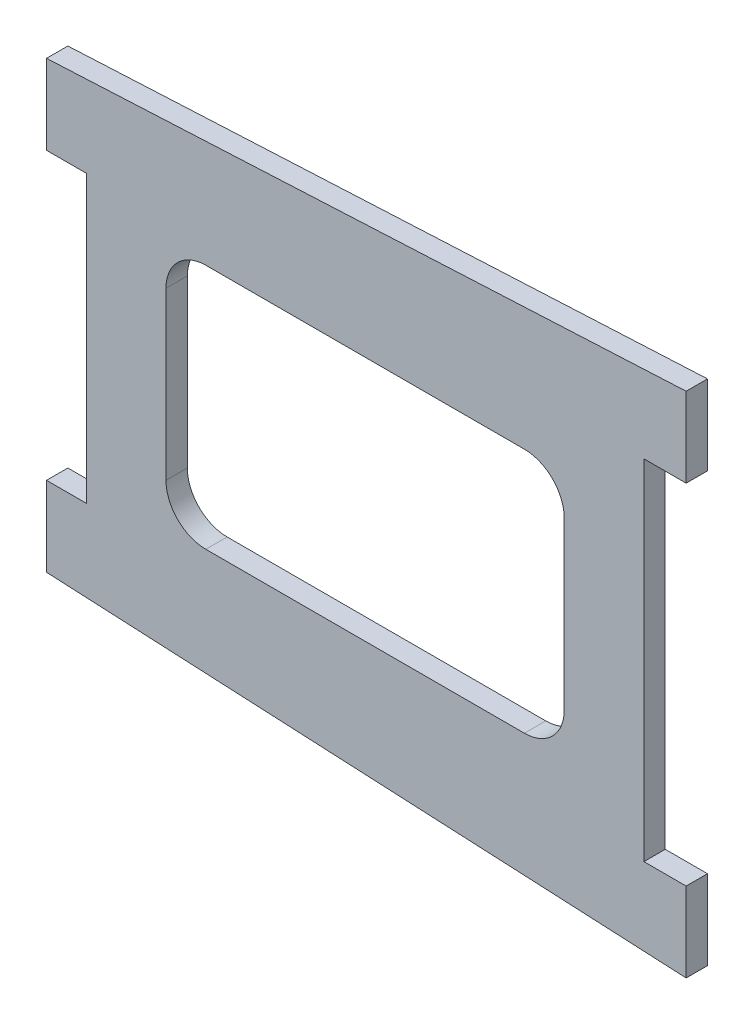
from build123d import *

# Parameters (mm, degrees)
BOSS_EXTRUDE1_DEPTH = 3.4036


with BuildPart() as part:
    # Sketch1 → Boss-Extrude1 (new body)
    with BuildSketch(Plane.XY):
        Polygon((8689.636759917, 2979.750055989), (8587.64819291, 2974.720855989), (8587.64819291, 2962.020855989), (8593.99819291, 2962.020855989), (8593.99819291, 2916.453255989), (8587.64819291, 2916.453255989), (8587.64819291, 2903.753255989), (8689.636759917, 2898.724055989), (8689.636759917, 2911.424055989), (8682.89819291, 2911.424055989), (8682.89819291, 2967.050055989), (8689.636759917, 2967.050055989), align=None)
        with BuildLine():
            Line((8606.69819291, 2952.495855989), (8606.69819291, 2925.978255989))
            ThreePointArc((8606.69819291, 2925.978255989), (8608.55806485, 2921.488127929), (8613.04819291, 2919.628255989))
            Line((8613.04819291, 2919.628255989), (8663.84819291, 2919.628255989))
            ThreePointArc((8663.84819291, 2919.628255989), (8668.338320971, 2921.488127929), (8670.19819291, 2925.978255989))
            Line((8670.19819291, 2925.978255989), (8670.19819291, 2952.495855989))
            ThreePointArc((8670.19819291, 2952.495855989), (8668.338320971, 2956.98598405), (8663.84819291, 2958.845855989))
            Line((8663.84819291, 2958.845855989), (8613.04819291, 2958.845855989))
            ThreePointArc((8613.04819291, 2958.845855989), (8608.55806485, 2956.98598405), (8606.69819291, 2952.495855989))
        make_face(mode=Mode.SUBTRACT)
    extrude(amount=BOSS_EXTRUDE1_DEPTH)


solid = part.part
